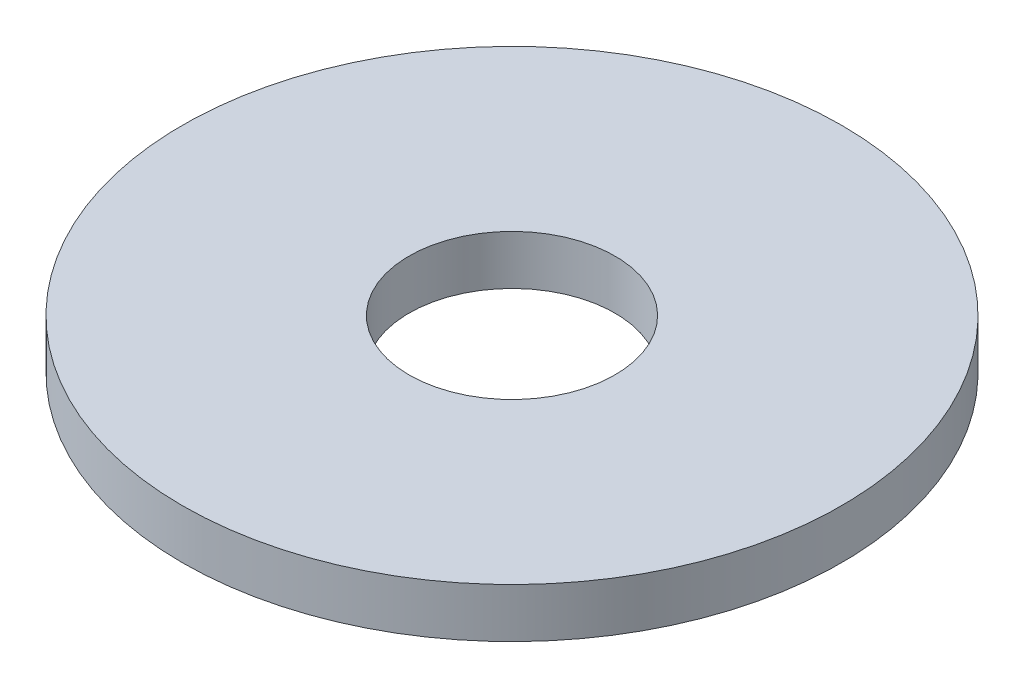
from build123d import *

# Parameters (mm, degrees)
SKETCH1_R           = 20
SKETCH1_R_2         = 6.25
BOSS_EXTRUDE1_DEPTH = 1.5


with BuildPart() as part:
    # Sketch1 → Boss-Extrude1 (new, symmetric)
    with BuildSketch(Plane(origin=(0, 0, 0), x_dir=(1, 0, 0), z_dir=(0, 1, 0))):
        with Locations(Location((0, 0, 0), (0, 0, 270))):
            Circle(SKETCH1_R)
        with Locations(Location((0, 0, 0), (0, 0, 270))):
            Circle(SKETCH1_R_2, mode=Mode.SUBTRACT)
    extrude(amount=BOSS_EXTRUDE1_DEPTH, both=True)


solid = part.part
